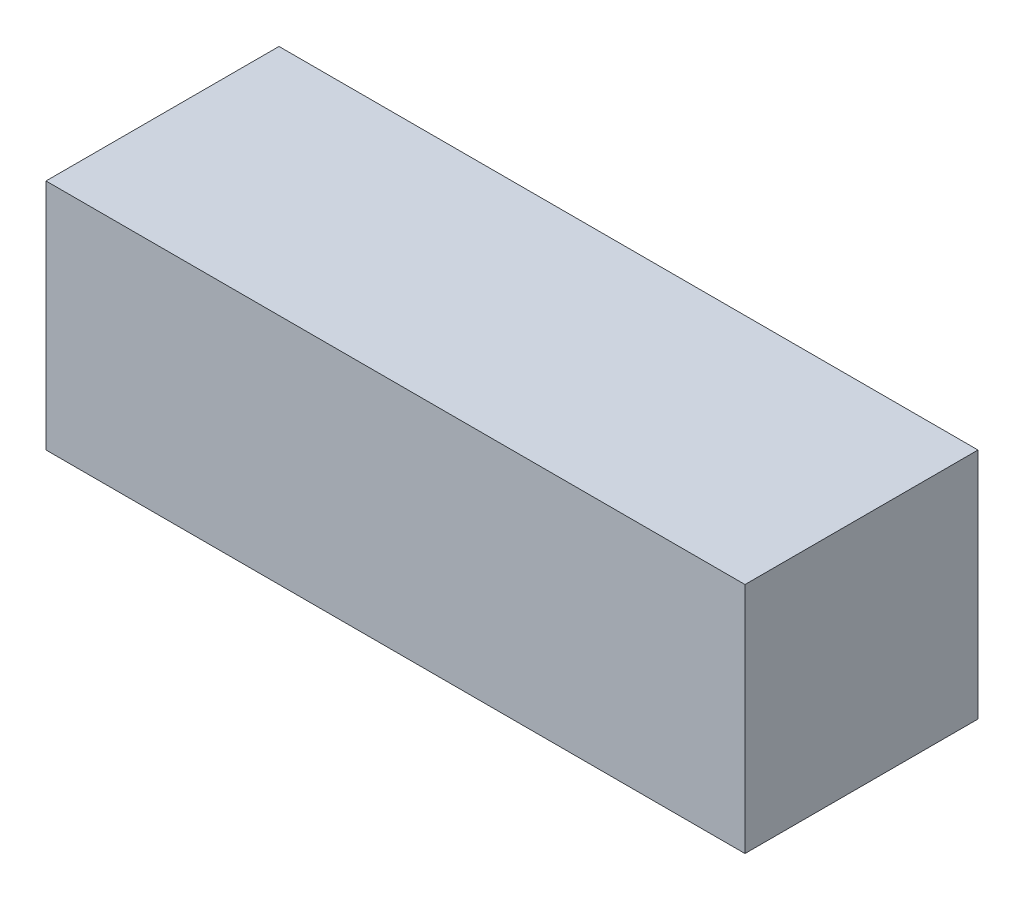
from build123d import *

# Parameters (mm, degrees)
SKETCH1_W      = 1.5
SKETCH1_H      = 0.5
EXTRUDE1_DEPTH = 0.5


with BuildPart() as part:
    # Sketch1 → Extrude1 (new body)
    with BuildSketch(Plane.XY):
        Rectangle(SKETCH1_W, SKETCH1_H)
    extrude(amount=EXTRUDE1_DEPTH)


solid = part.part
